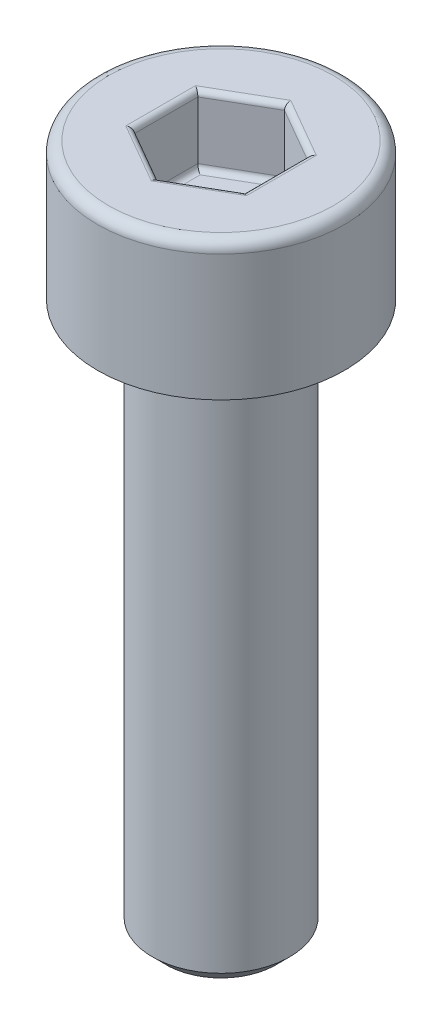
from build123d import *

# Parameters (mm, degrees)
CHAMFER1_SIZE      = 0.25
FILLET1_R          = 0.2
CUT_EXTRUDE1_DEPTH = 1.25
FILLET2_R          = 0.1


with BuildPart() as part:
    # Sketch1 → Revolve1 (revolve)
    with BuildSketch(Plane.XY, mode=Mode.PRIVATE) as revolve1_sk:
        Polygon((0, -12.5), (-1.25, -12.5), (-1.25, -2.5), (-2.25, -2.5), (-2.25, 0), (0, 0), align=None)
    revolve(revolve1_sk.sketch.rotate(Axis((0, 0, 0), (0, -1, 0)), 270), axis=Axis((0, 0, 0), (0, -1, 0)))

    # Chamfer1
    chamfer1_edges = [part.edges().sort_by_distance(p)[0] for p in [
        (0, -2.5, -1.25),
        (0, -12.5, -1.25),
    ]]
    chamfer(chamfer1_edges, length=CHAMFER1_SIZE)

    # Fillet1
    fillet1_edges = [part.edges().sort_by_distance(p)[0] for p in [
        (0, 0, -2.25),
    ]]
    fillet(fillet1_edges, radius=FILLET1_R)

    # Sketch2 → Cut-Extrude1 (cut)
    with BuildSketch(Plane(origin=(0, 0, 0), x_dir=(1, 0, 0), z_dir=(0, 1, 0))):
        Polygon((0, 1.154700538), (-1, 0.577350269), (-1, -0.577350269), (0, -1.154700538), (1, -0.577350269), (1, 0.577350269), align=None)
    extrude(amount=-CUT_EXTRUDE1_DEPTH, mode=Mode.SUBTRACT)

    # Fillet2
    fillet2_edges = [part.edges().sort_by_distance(p)[0] for p in [
        (0.5, -1.25, -0.866025404),
        (1, -1.25, 0),
        (0.5, -1.25, 0.866025404),
        (-0.5, -1.25, 0.866025404),
        (-1, -1.25, 0),
        (-0.5, -1.25, -0.866025404),
        (0.4999999999999987, 0, -0.8660254037844397),
        (-0.5000000000000006, 0, -0.8660254037844395),
        (-1, 0, 0),
        (-0.5000000000000007, 0, 0.8660254037844379),
        (0.4999999999999988, 0, 0.8660254037844382),
        (1, 0, 0),
    ]]
    fillet(fillet2_edges, radius=FILLET2_R)


solid = part.part
